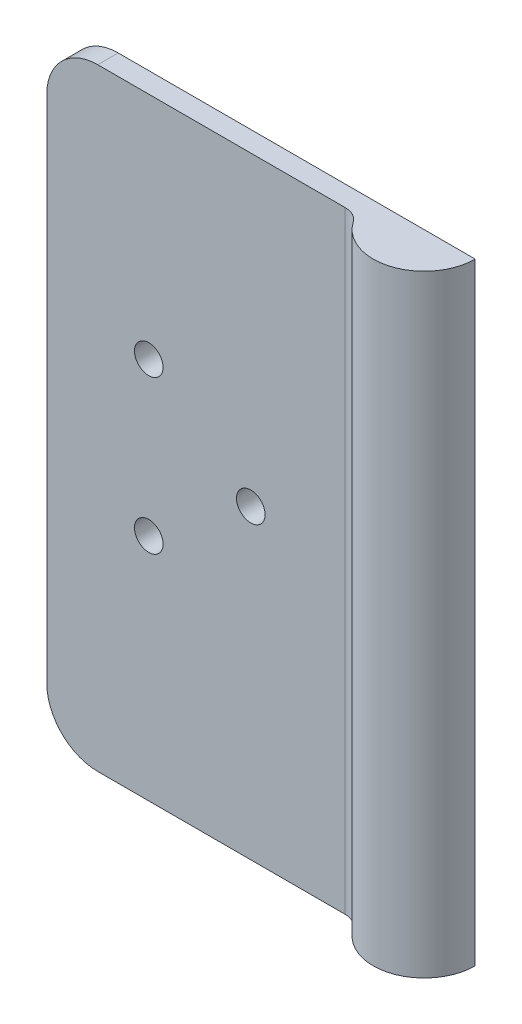
from build123d import *

# Parameters (mm, degrees)
SKETCH1_R           = 1.4
BOSS_EXTRUDE1_DEPTH = 2
BOSS_EXTRUDE2_DEPTH = 60
CUT_EXTRUDE1_DEPTH  = 60
FILLET1_R           = 2


with BuildPart() as part:
    # Sketch1 → Boss-Extrude1 (new body)
    with BuildSketch(Plane(origin=(0, 0, -2), x_dir=(-1, 0, 0), z_dir=(0, 0, -1))):
        with BuildLine():
            Line((60.9850693, 26.806434403), (30.9850693, 26.806434403))
            ThreePointArc((30.9850693, 26.806434403), (27.449535394, 25.341968309), (25.9850693, 21.806434403))
            Line((25.9850693, 21.806434403), (25.9850693, -28.193565597))
            ThreePointArc((25.9850693, -28.193565597), (27.449535394, -31.729099503), (30.9850693, -33.193565597))
            Line((30.9850693, -33.193565597), (60.9850693, -33.193565597))
            ThreePointArc((60.9850693, -33.193565597), (64.520603206, -31.729099503), (65.9850693, -28.193565597))
            Line((65.9850693, -28.193565597), (65.9850693, 21.806434403))
            ThreePointArc((65.9850693, 21.806434403), (64.520603206, 25.341968309), (60.9850693, 26.806434403))
        make_face()
        with Locations((55.9850693, 4.306434403)):
            Circle(SKETCH1_R, mode=Mode.SUBTRACT)
        with Locations((55.9850693, -10.693565597)):
            Circle(SKETCH1_R, mode=Mode.SUBTRACT)
        with Locations((45.9850693, -3.193565597)):
            Circle(SKETCH1_R, mode=Mode.SUBTRACT)
    extrude(amount=-BOSS_EXTRUDE1_DEPTH)

    # Sketch2 → Boss-Extrude2 (add)
    with BuildSketch(Plane(origin=(0, 26.806434403, 0), x_dir=(1, 0, 0), z_dir=(0, 1, 0))):
        with BuildLine():
            Line((-25.9850693, 2), (-35.9850693, 2))
            ThreePointArc((-35.9850693, 2), (-30.9850693, -3), (-25.9850693, 2))
        make_face()
    extrude(amount=-BOSS_EXTRUDE2_DEPTH)

    # Sketch3 → Cut-Extrude1 (cut)
    with BuildSketch(Plane(origin=(0, 26.806434403, 0), x_dir=(1, 0, 0), z_dir=(0, 1, 0))):
        with BuildLine():
            Line((-26.402493605, 0), (-25.9850693, 0))
            Line((-25.9850693, 0), (-25.9850693, 2))
            ThreePointArc((-25.9850693, 2), (-26.090537735, 0.978451782), (-26.402493605, 0))
        make_face()
    extrude(amount=-CUT_EXTRUDE1_DEPTH, mode=Mode.SUBTRACT)

    # Fillet1
    fillet1_edges = [part.edges().sort_by_distance(p)[0] for p in [
        (-35.567644995, -3.193565597, 0),
    ]]
    fillet(fillet1_edges, radius=FILLET1_R)


solid = part.part
